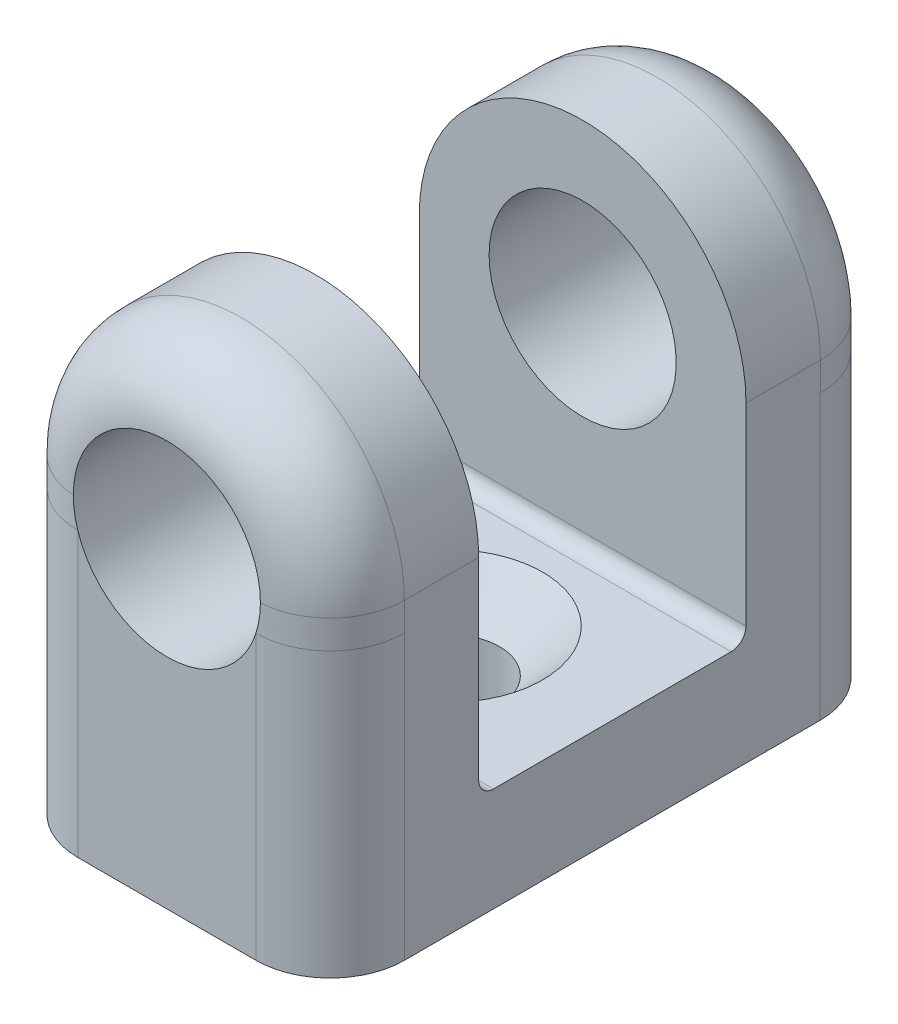
from build123d import *

# Parameters (mm, degrees)
ESQUISSE1_R                                    = 3.15
BOSS_EXTRU_1_DEPTH                             = 19
ESQUISSE2_W                                    = 9
ESQUISSE2_H                                    = 12.5
ENL_V_MAT_EXTRU_1_DEPTH                        = 15
FRAISAGE_POUR_VIS_T_TE_FRAIS_E_M31_D           = 3.4
FRAISAGE_POUR_VIS_T_TE_FRAIS_E_M31_CSINK_D     = 6.3
FRAISAGE_POUR_VIS_T_TE_FRAIS_E_M31_CSINK_ANGLE = 90
CONG_1_R                                       = 2.5
CONG_2_R                                       = 0.5


with BuildPart() as part:
    # Esquisse1 → Boss.-Extru.1 (new body)
    with BuildSketch(Plane.XY):
        with BuildLine():
            Line((-5.5, 3.5), (-5.5, 14))
            ThreePointArc((-5.5, 14), (0, 19.5), (5.5, 14))
            Line((5.5, 14), (5.5, 3.5))
            Line((5.5, 3.5), (-5.5, 3.5))
        make_face()
        with Locations((0, 14)):
            Circle(ESQUISSE1_R, mode=Mode.SUBTRACT)
    extrude(amount=BOSS_EXTRU_1_DEPTH)

    # Esquisse2 → Enlèv. mat.-Extru.1 (cut)
    with BuildSketch(Plane(origin=(5.5, 0, 0), x_dir=(0, 0, -1), z_dir=(1, 0, 0))):
        with Locations((-9.5, 13.25)):
            Rectangle(ESQUISSE2_W, ESQUISSE2_H)
    extrude(amount=-ENL_V_MAT_EXTRU_1_DEPTH, mode=Mode.SUBTRACT)

    # Fraisage pour vis à tête fraisée M31 (through all)
    with Locations(Plane(origin=(0, 7, 0), x_dir=(1, 0, 0), z_dir=(0, 1, 0))):
        with Locations((0, -9.5)):
            CounterSinkHole(FRAISAGE_POUR_VIS_T_TE_FRAIS_E_M31_D / 2, FRAISAGE_POUR_VIS_T_TE_FRAIS_E_M31_CSINK_D / 2, counter_sink_angle=FRAISAGE_POUR_VIS_T_TE_FRAIS_E_M31_CSINK_ANGLE)

    # Congé1
    cong_1_edges = [part.edges().sort_by_distance(p)[0] for p in [
        (5.5, 8.75, 0),
        (5.5, 8.75, 19),
        (-5.5, 8.75, 19),
        (-5.5, 8.75, 0),
    ]]
    fillet(cong_1_edges, radius=CONG_1_R)

    # Congé2
    cong_2_edges = [part.edges().sort_by_distance(p)[0] for p in [
        (0, 7, 14),
        (0, 7, 5),
    ]]
    fillet(cong_2_edges, radius=CONG_2_R)


solid = part.part
